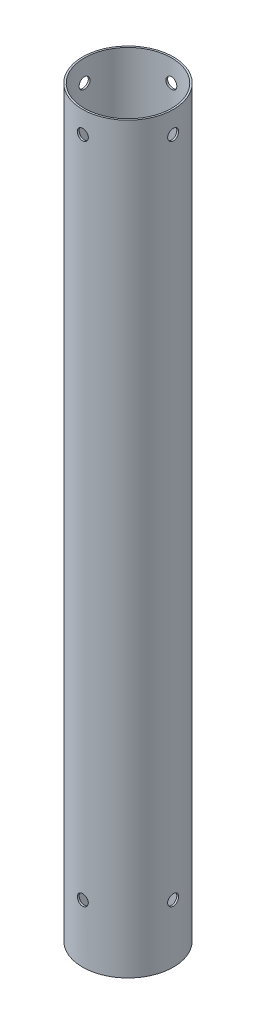
from build123d import *

# Parameters (mm, degrees)
SKETCH1_R           = 39.624
SKETCH1_R_2         = 38.1
BOSS_EXTRUDE1_DEPTH = 647.7
CUT_EXTRUDE1_DEPTH  = 654.732052817
CIRPATTERN1_COUNT   = 4


with BuildPart() as part:
    # Sketch1 → Boss-Extrude1 (new body)
    with BuildSketch(Plane(origin=(0, 0, 0), x_dir=(1, 0, 0), z_dir=(0, 1, 0))):
        with Locations(Location((0, 0, 0), (0, 0, 270))):
            Circle(SKETCH1_R)
        with Locations(Location((0, 0, 0), (0, 0, 270))):
            Circle(SKETCH1_R_2, mode=Mode.SUBTRACT)
    extrude(amount=BOSS_EXTRUDE1_DEPTH)

    # Sketch2 → Cut-Extrude1 (cut, through all)
    with BuildSketch(Plane(origin=(39.624, 0, 0), x_dir=(0, 0, -1), z_dir=(1, 0, 0))):
        with BuildLine():
            ThreePointArc((4.7625, 628.65), (3.367596045, 632.017596045), (0, 633.4125))
            Line((0, 633.4125), (0, 628.65))
            Line((0, 628.65), (4.7625, 628.65))
        make_face()
        with BuildLine():
            Line((0, 628.65), (0, 633.4125))
            ThreePointArc((0, 633.4125), (-3.367596045, 632.017596045), (-4.7625, 628.65))
            Line((-4.7625, 628.65), (0, 628.65))
        make_face()
        with BuildLine():
            Line((4.7625, 628.65), (0, 628.65))
            Line((0, 628.65), (0, 623.8875))
            ThreePointArc((0, 623.8875), (3.367596045, 625.282403955), (4.7625, 628.65))
        make_face()
        with BuildLine():
            Line((0, 623.8875), (0, 628.65))
            Line((0, 628.65), (-4.7625, 628.65))
            ThreePointArc((-4.7625, 628.65), (-3.367596045, 625.282403955), (0, 623.8875))
        make_face()
        with BuildLine():
            ThreePointArc((4.7625, 50.8), (3.367596045, 54.167596045), (0, 55.5625))
            Line((0, 55.5625), (0, 50.8))
            Line((0, 50.8), (4.7625, 50.8))
        make_face()
        with BuildLine():
            Line((0, 50.8), (0, 55.5625))
            ThreePointArc((0, 55.5625), (-3.367596045, 54.167596045), (-4.7625, 50.8))
            Line((-4.7625, 50.8), (0, 50.8))
        make_face()
        with BuildLine():
            Line((4.7625, 50.8), (0, 50.8))
            Line((0, 50.8), (0, 46.0375))
            ThreePointArc((0, 46.0375), (3.367596045, 47.432403955), (4.7625, 50.8))
        make_face()
        with BuildLine():
            Line((0, 46.0375), (0, 50.8))
            Line((0, 50.8), (-4.7625, 50.8))
            ThreePointArc((-4.7625, 50.8), (-3.367596045, 47.432403955), (0, 46.0375))
        make_face()
    cut_extrude1 = extrude(amount=-CUT_EXTRUDE1_DEPTH, mode=Mode.SUBTRACT)

    # CirPattern1: Cut-Extrude1 ×4 about axis
    cirpattern1_axis = Axis((0, 647.7, 0), (0, -1, 0))
    for i in range(1, CIRPATTERN1_COUNT):
        add(cut_extrude1.rotate(cirpattern1_axis, i * 360 / CIRPATTERN1_COUNT), mode=Mode.SUBTRACT)


solid = part.part
